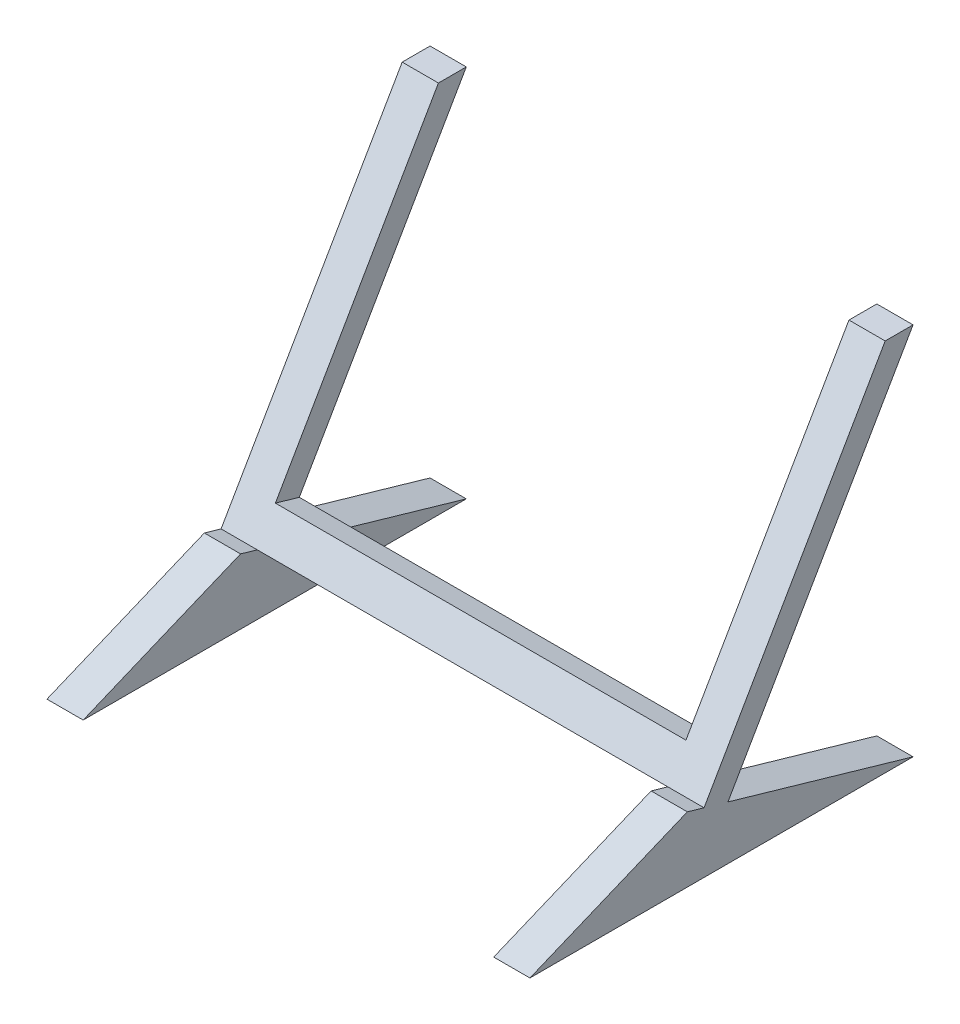
from build123d import *

# Parameters (mm, degrees)
BOSS_EXTRUDE1_DEPTH = 3
BOSS_EXTRUDE3_DEPTH = 17


with BuildPart() as part:
    # Sketch1 → Boss-Extrude1 (new body)
    with BuildSketch(Plane(origin=(0, 0, 0), x_dir=(0, 0, -1), z_dir=(1, 0, 0))):
        Polygon((0, 0), (-12.814351741, 0), (0.221356727, 5.4), (1.606108813, 5), (16.606108813, 30.980762114), (18.91550989, 30.980762114), (3.585414012, 4.428257168), (18.91550989, 0), align=None)
    boss_extrude1 = extrude(amount=BOSS_EXTRUDE1_DEPTH)

    # Sketch3 → Boss-Extrude3 (add)
    with BuildSketch(Plane(origin=(20, 0, 0), x_dir=(0, 0, -1), z_dir=(1, 0, 0))):
        Polygon((3.585414012, 4.428257168), (1.606108813, 5), (3.106108813, 7.598076211), (5.085414012, 7.026333379), align=None)
    boss_extrude3 = extrude(amount=-BOSS_EXTRUDE3_DEPTH)

    # Mirror5: Boss-Extrude3 across plane
    add(boss_extrude3.mirror(Plane(origin=(20, 0, 0), x_dir=(0, 0, 1), z_dir=(1, 0, 0))))

    # Mirror6: Boss-Extrude1 across plane
    add(boss_extrude1.mirror(Plane(origin=(20, 0, 0), x_dir=(0, 0, 1), z_dir=(1, 0, 0))))


solid = part.part
